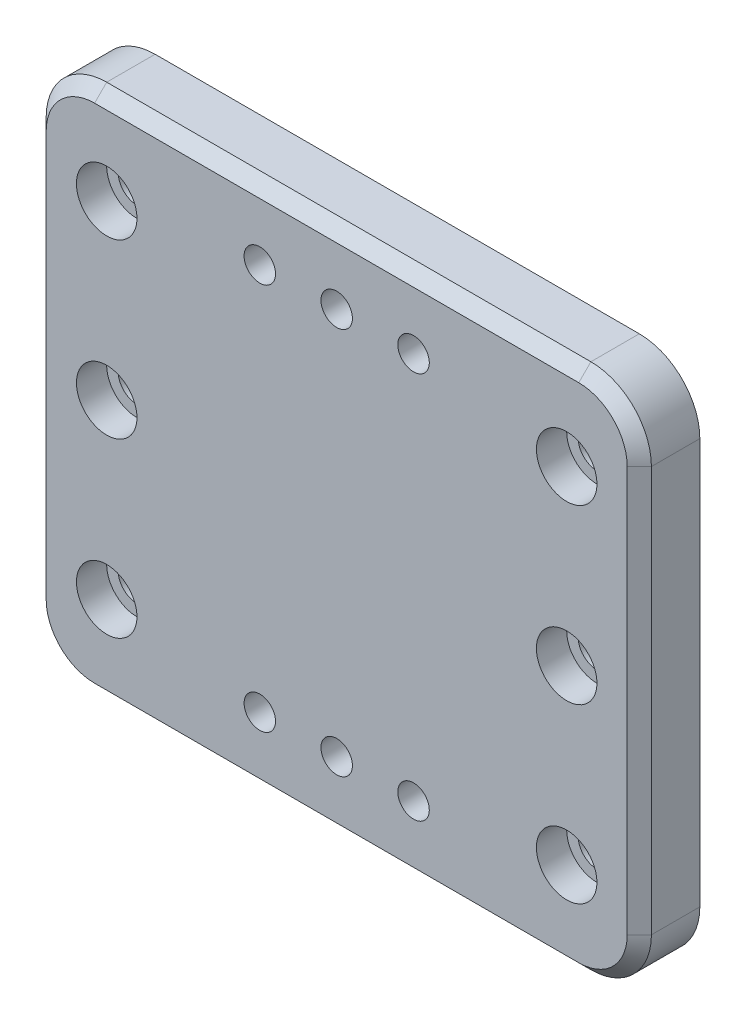
from build123d import *

# Parameters (mm, degrees)
SKETCH_1_W          = 100
SKETCH_1_H          = 87
EXTRUDE_1_DEPTH     = 10
FILLET_1_R          = 10
SKETCH_2_R          = 2.6
CUT_EXTRUDE_1_DEPTH = 10
SKETCH_3_R          = 5
CUT_EXTRUDE_2_DEPTH = 5
SKETCH_4_R          = 3.1
CUT_EXTRUDE_3_DEPTH = 5
CHAMFER_1_SIZE      = 1
CHAMFER_2_SIZE      = 2


with BuildPart() as part:
    # 草图1 → 凸台-拉伸1 (new body)
    with BuildSketch(Plane.XY):
        Rectangle(SKETCH_1_W, SKETCH_1_H)
    extrude(amount=EXTRUDE_1_DEPTH)

    # 圆角1
    fillet_1_edges = [part.edges().sort_by_distance(p)[0] for p in [
        (50, -43.5, 5),
        (-50, -43.5, 5),
        (-50, 43.5, 5),
        (50, 43.5, 5),
    ]]
    fillet(fillet_1_edges, radius=FILLET_1_R)

    # 草图2 → 切除-拉伸1 (cut)
    with BuildSketch(Plane.XY.offset(10)):
        with Locations((0, 32)):
            Circle(SKETCH_2_R)
        with Locations((-12.7, 32)):
            Circle(SKETCH_2_R)
        with Locations(Location((12.7, 32, 0), (0, 0, 180))):
            Circle(SKETCH_2_R)
        with Locations((-12.7, -32)):
            Circle(SKETCH_2_R)
        with Locations((0, -32)):
            Circle(SKETCH_2_R)
        with Locations((12.7, -32)):
            Circle(SKETCH_2_R)
    extrude(amount=-CUT_EXTRUDE_1_DEPTH, mode=Mode.SUBTRACT)

    # 草图3 → 切除-拉伸2 (cut)
    with BuildSketch(Plane.XY.offset(10)):
        with Locations((-38, 28.5)):
            Circle(SKETCH_3_R)
        with Locations((-38, 0)):
            Circle(SKETCH_3_R)
        with Locations((-38, -28.5)):
            Circle(SKETCH_3_R)
        with Locations(Location((38, -28.5, 0), (0, 0, 180))):
            Circle(SKETCH_3_R)
        with Locations(Location((38, 0, 0), (0, 0, 180))):
            Circle(SKETCH_3_R)
        with Locations(Location((38, 28.5, 0), (0, 0, 180))):
            Circle(SKETCH_3_R)
    extrude(amount=-CUT_EXTRUDE_2_DEPTH, mode=Mode.SUBTRACT)

    # 草图4 → 切除-拉伸3 (cut)
    with BuildSketch(Plane.XY.offset(5)):
        with Locations((-38, 28.5)):
            Circle(SKETCH_4_R)
        with Locations((-38, 0)):
            Circle(SKETCH_4_R)
        with Locations((-38, -28.5)):
            Circle(SKETCH_4_R)
        with Locations((38, 28.5)):
            Circle(SKETCH_4_R)
        with Locations((38, 0)):
            Circle(SKETCH_4_R)
        with Locations((38, -28.5)):
            Circle(SKETCH_4_R)
    extrude(amount=-CUT_EXTRUDE_3_DEPTH, mode=Mode.SUBTRACT)

    # 倒角1
    chamfer_1_edges = [part.edges().sort_by_distance(p)[0] for p in [
        (34.9, 0, 0),
        (34.9, -28.5, 0),
        (-41.1, 28.5, 0),
        (-41.1, 0, 0),
        (-41.1, -28.5, 0),
        (34.9, 28.5, 0),
    ]]
    chamfer(chamfer_1_edges, length=CHAMFER_1_SIZE)

    # 倒角2
    chamfer_2_edges = [part.edges().sort_by_distance(p)[0] for p in [
        (0, 43.5, 10),
        (50, 0, 10),
        (-50, 0, 10),
        (0, -43.5, 10),
        (-47.071067812, -40.571067812, 10),
        (47.071067812, -40.571067812, 10),
        (-47.071067812, 40.571067812, 10),
        (47.071067812, 40.571067812, 10),
    ]]
    chamfer(chamfer_2_edges, length=CHAMFER_2_SIZE)


solid = part.part
